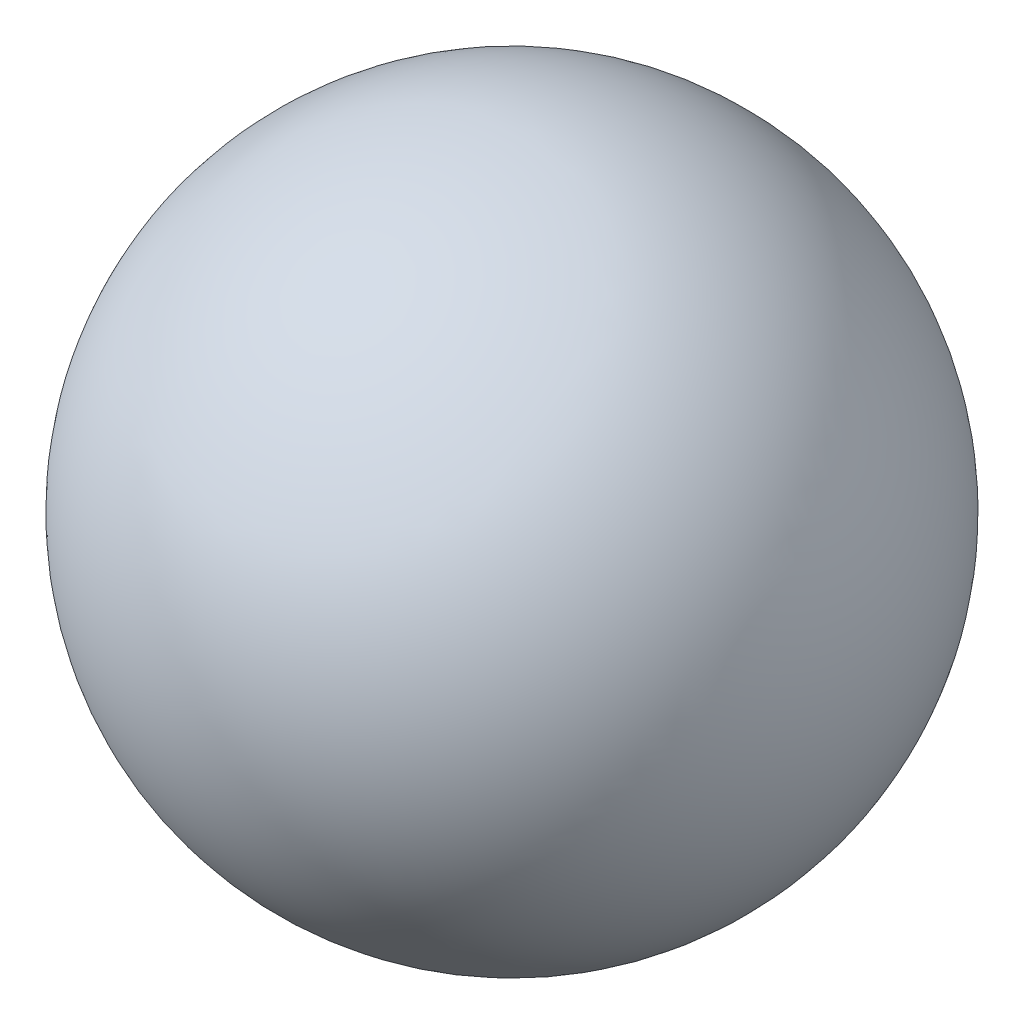
from build123d import *


with BuildPart() as part:
    # 草图1 → 旋转1 (revolve)
    with BuildSketch(Plane.XY):
        with BuildLine():
            Line((0, 0), (240, 0))
            ThreePointArc((240, 0), (120, 120), (0, 0))
        make_face()
    revolve(axis=Axis((0, 0, 0), (1, 0, 0)))


solid = part.part
